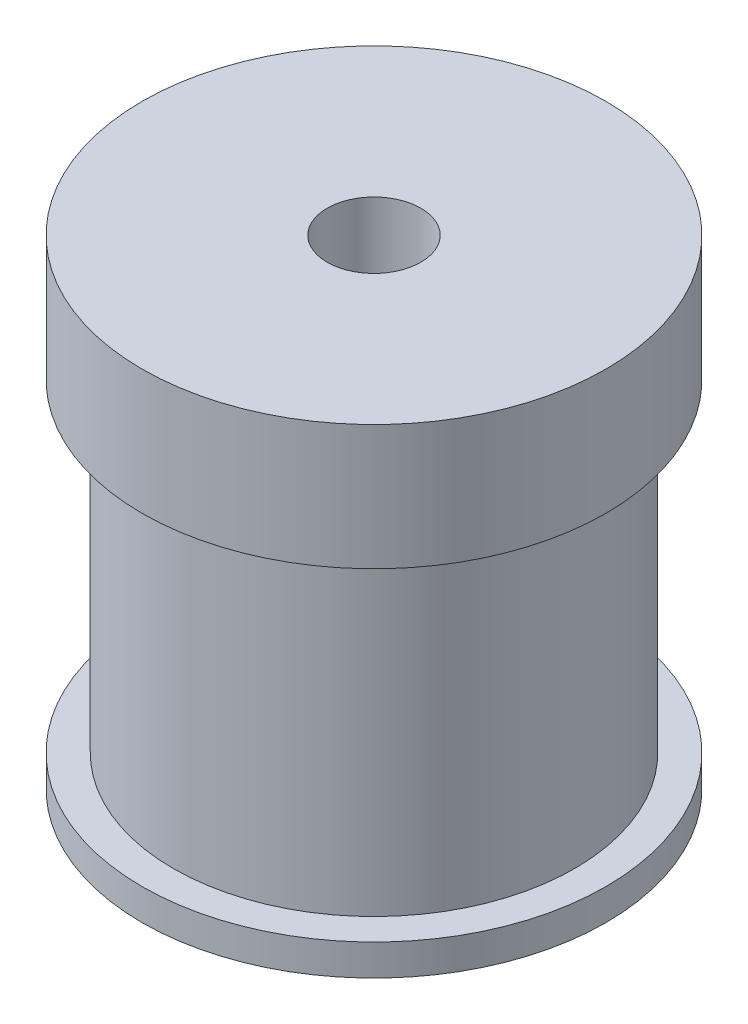
from build123d import *

# Parameters (mm, degrees)
SKETCH1_R           = 7.425
BOSS_EXTRUDE1_DEPTH = 1
SKETCH2_R           = 6.425
BOSS_EXTRUDE2_DEPTH = 10.35
SKETCH3_R           = 7.425
BOSS_EXTRUDE3_DEPTH = 4
SKETCH4_R           = 1.5
CUT_EXTRUDE1_DEPTH  = 15.35


with BuildPart() as part:
    # Sketch1 → Boss-Extrude1 (new body)
    with BuildSketch(Plane(origin=(0, 0, 0), x_dir=(1, 0, 0), z_dir=(0, 1, 0))):
        with Locations(Location((0, 0, 0), (0, 0, 270))):
            Circle(SKETCH1_R)
    extrude(amount=BOSS_EXTRUDE1_DEPTH)

    # Sketch2 → Boss-Extrude2 (add)
    with BuildSketch(Plane(origin=(0, 1, 0), x_dir=(1, 0, 0), z_dir=(0, 1, 0))):
        with Locations(Location((0, 0, 0), (0, 0, 270))):
            Circle(SKETCH2_R)
    extrude(amount=BOSS_EXTRUDE2_DEPTH)

    # Sketch3 → Boss-Extrude3 (add)
    with BuildSketch(Plane(origin=(0, 11.35, 0), x_dir=(1, 0, 0), z_dir=(0, 1, 0))):
        with Locations(Location((0, 0, 0), (0, 0, 270))):
            Circle(SKETCH3_R)
    extrude(amount=BOSS_EXTRUDE3_DEPTH)

    # Sketch4 → Cut-Extrude1 (cut)
    with BuildSketch(Plane(origin=(0, 15.35, 0), x_dir=(1, 0, 0), z_dir=(0, 1, 0))):
        with Locations(Location((0, 0, 0), (0, 0, 270))):
            Circle(SKETCH4_R)
    extrude(amount=-CUT_EXTRUDE1_DEPTH, mode=Mode.SUBTRACT)


solid = part.part
